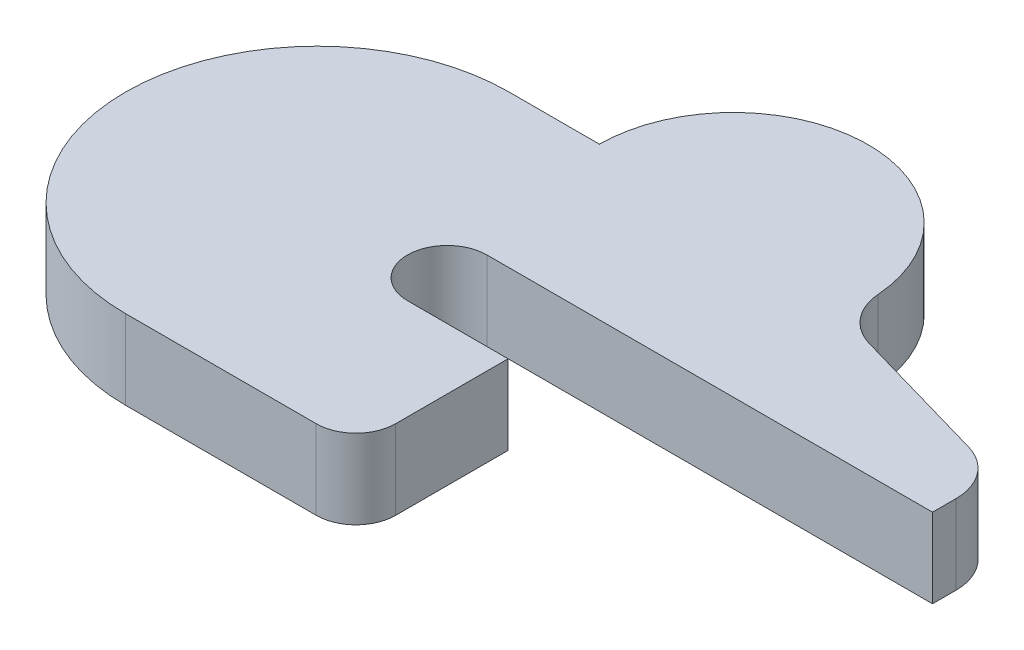
from build123d import *

# Parameters (mm, degrees)
BOSS_EXTRUDE2_DEPTH = 3


with BuildPart() as part:
    # Sketch1 → Boss-Extrude2 (new body)
    with BuildSketch(Plane(origin=(0, 0, 0), x_dir=(1, 0, 0), z_dir=(0, 1, 0))):
        with BuildLine():
            Line((0, 0), (-3.8, 0))
            ThreePointArc((-3.8, 0), (-5.3, 1.5), (-3.8, 3))
            Line((-3.8, 3), (13.04, 3))
            Line((13.04, 3), (13.04, 3.892691809))
            ThreePointArc((13.04, 3.892691809), (12.63727102, 5.096321856), (11.591274712, 5.815215201))
            Line((11.591274712, 5.815215201), (6.328678515, 7.324240378))
            ThreePointArc((6.328678515, 7.324240378), (5.329034294, 7.983969065), (4.885600205, 9.096577136))
            ThreePointArc((4.885600205, 9.096577136), (-0.391623267, 13.81), (-5.3, 8.71360122))
            Line((-5.3, 8.71360122), (-5.3, 8.75))
            Line((-5.3, 8.75), (-8.71, 8.75))
            ThreePointArc((-8.71, 8.75), (-15.96, 1.5), (-8.71, -5.75))
            Line((-8.71, -5.75), (-1.5, -5.75))
            ThreePointArc((-1.5, -5.75), (-0.439339828, -5.310660172), (0, -4.25))
            Line((0, -4.25), (0, 0))
        make_face()
    extrude(amount=BOSS_EXTRUDE2_DEPTH)


solid = part.part
